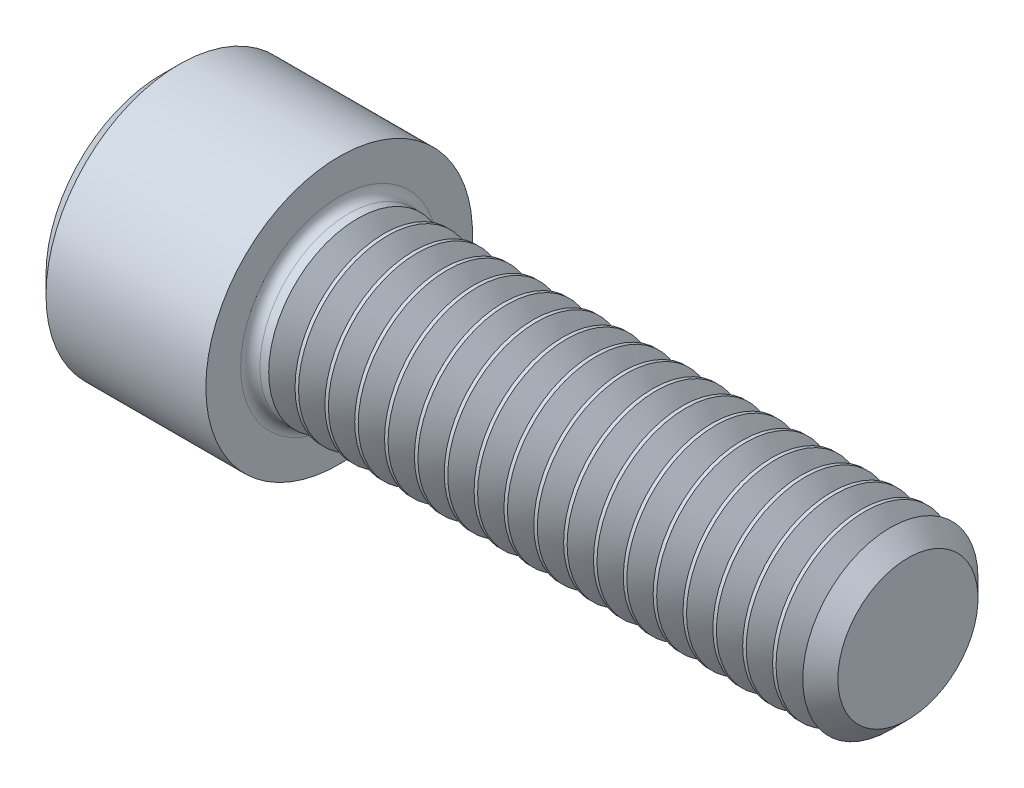
from build123d import *

# Parameters (mm, degrees)
FILLET1_R       = 0.4318
HEX_2_DEPTH     = 3.8354
THDSCHPAT_COUNT = 18
THDSCHPAT_PITCH = 1.332794444


with BuildPart() as part:
    # BodySke → Base-Revolve (revolve)
    with BuildSketch(Plane.XY, mode=Mode.PRIVATE) as base_revolve_sk:
        Polygon((0, 0), (0, 5.15366), (0.8001, 5.95376), (7.9375, 5.95376), (7.9375, 3.96875), (32.49803, 3.96875), (33.3375, 3.12928), (33.3375, 0), align=None)
    revolve(base_revolve_sk.sketch.rotate(Axis((-31.75, 0, 0), (1, 0, 0)), 90), axis=Axis((-31.75, 0, 0), (1, 0, 0)))

    # Fillet1
    fillet1_edges = [part.edges().sort_by_distance(p)[0] for p in [
        (7.9375, 0, -3.96875),
    ]]
    fillet(fillet1_edges, radius=FILLET1_R)

    # Sketch2 → Hex-PreBroach (revolve, cut)
    with BuildSketch(Plane.XY, mode=Mode.PRIVATE) as hex_prebroach_sk:
        Polygon((0, 3.175), (3.8354, 3.175), (5.668487105, 0), (0, 0), align=None)
    revolve(hex_prebroach_sk.sketch.rotate(Axis((0, 0, 0), (1, 0, 0)), 90), axis=Axis((0, 0, 0), (1, 0, 0)), mode=Mode.SUBTRACT)

    # Sketch3 → Hex 2 (cut)
    with BuildSketch(Plane(origin=(0, 0, 0), x_dir=(0, 0.500000000000001, 0.866025403784438), z_dir=(-1, 0, 0))):
        Polygon((1.833087105, 3.175), (-1.833087105, 3.175), (-3.666174209, 0), (-1.833087105, -3.175), (1.833087105, -3.175), (3.666174209, 0), align=None)
    extrude(amount=-HEX_2_DEPTH, mode=Mode.SUBTRACT)

    # ThdSchSke → ThreadSchematic (revolve, cut)
    with BuildSketch(Plane.XY):
        Polygon((9.3472, -3.12928), (8.759396778, -3.96875), (8.759396778, -4.9609375), (9.935003222, -4.9609375), (9.935003222, -3.96875), align=None)
    threadschematic = revolve(axis=Axis((-3.175, 0, 0), (1, 0, 0)), mode=Mode.SUBTRACT)

    # ThdSchPat: ThreadSchematic ×18
    with Locations(*[(i * THDSCHPAT_PITCH, 0, 0) for i in range(1, THDSCHPAT_COUNT)]):
        add(threadschematic, mode=Mode.SUBTRACT)


solid = part.part
